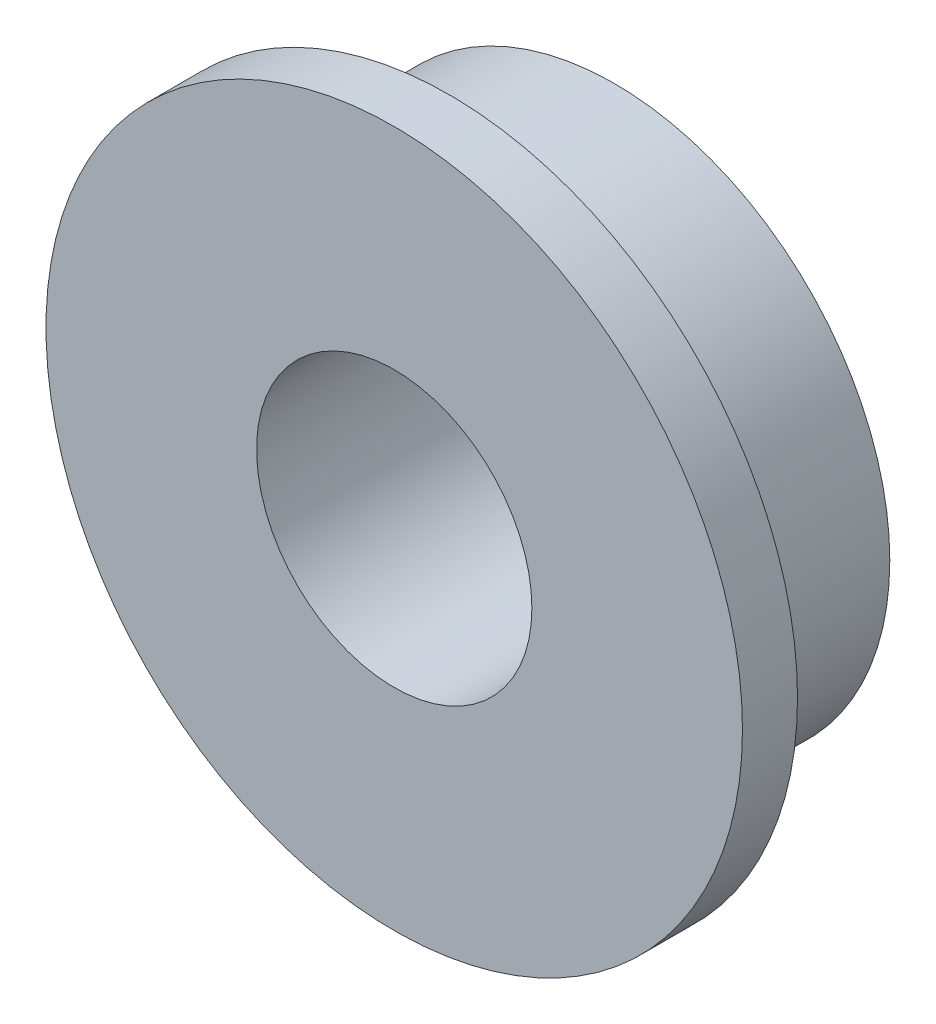
from build123d import *

# Parameters (mm, degrees)
SKETCH_1_R      = 5
SKETCH_1_R_2    = 2.5
EXTRUDE_1_DEPTH = 4
EXTRUDE_START   = -1
SKETCH_2_R      = 6.324200638
SKETCH_2_R_2    = 2.5
EXTRUDE_2_DEPTH = 1


with BuildPart() as part:
    # 草图1 → 凸台-拉伸1 (new body)
    with BuildSketch(Plane.XY):
        with Locations((0.69054098, 1.468914548)):
            Circle(SKETCH_1_R)
        with Locations((0.69054098, 1.468914548)):
            Circle(SKETCH_1_R_2, mode=Mode.SUBTRACT)
    extrude(amount=EXTRUDE_1_DEPTH)

    # 草图2 → 凸台-拉伸2 (add)
    with BuildSketch(Plane.XY.offset(4).offset(EXTRUDE_START)):
        with Locations((0.69054098, 1.468914548)):
            Circle(SKETCH_2_R)
        with Locations((0.69054098, 1.468914548)):
            Circle(SKETCH_2_R_2, mode=Mode.SUBTRACT)
    extrude(amount=EXTRUDE_2_DEPTH)


solid = part.part
